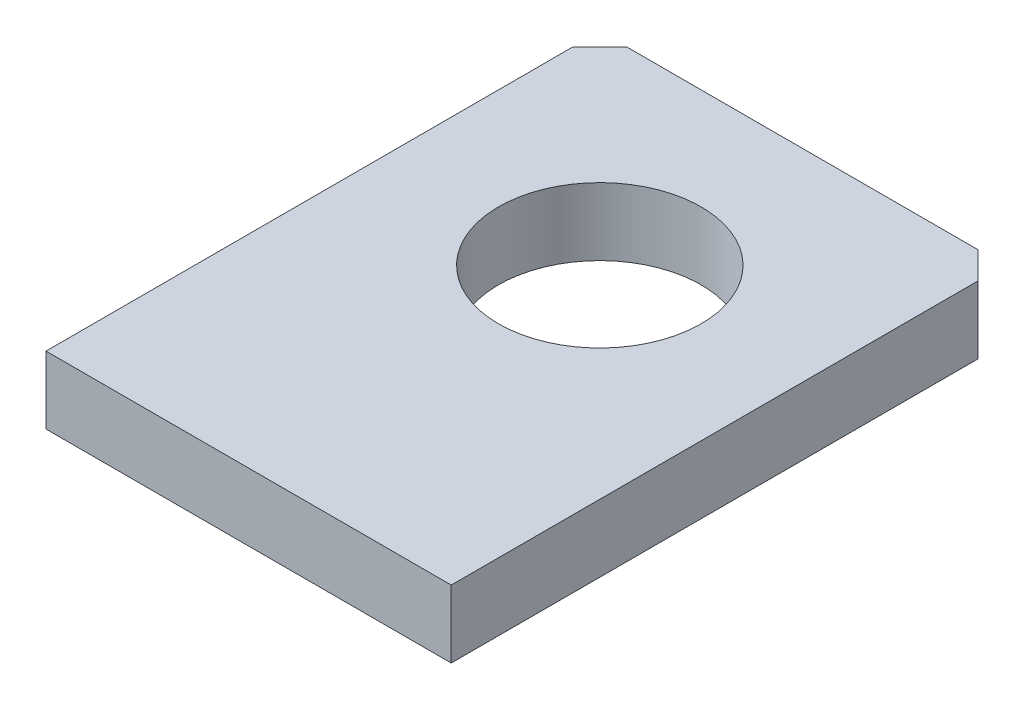
from build123d import *

# Parameters (mm, degrees)
CROQUIS1_W              = 3
CROQUIS1_H              = 4.1
SALIENTE_EXTRUIR1_DEPTH = 0.5
CHAFL_N1_SIZE           = 0.2
CROQUIS2_R              = 0.75
CORTAR_EXTRUIR1_DEPTH   = 0.5


with BuildPart() as part:
    # Croquis1 → Saliente-Extruir1 (new body)
    with BuildSketch(Plane(origin=(0, 0, 0), x_dir=(1, 0, 0), z_dir=(0, 1, 0))):
        Rectangle(CROQUIS1_W, CROQUIS1_H)
    extrude(amount=SALIENTE_EXTRUIR1_DEPTH)

    # Chaflán1
    chafl_n1_edges = [part.edges().sort_by_distance(p)[0] for p in [
        (-1.5, 0.25, -2.05),
        (1.5, 0.25, -2.05),
    ]]
    chamfer(chafl_n1_edges, length=CHAFL_N1_SIZE)

    # Croquis2 → Cortar-Extruir1 (cut)
    with BuildSketch(Plane(origin=(0, 0.5, 0), x_dir=(1, 0, 0), z_dir=(0, 1, 0))):
        with Locations(Location((0, 0.55, 0), (0, 0, 270))):
            Circle(CROQUIS2_R)
    extrude(amount=-CORTAR_EXTRUIR1_DEPTH, mode=Mode.SUBTRACT)


solid = part.part
